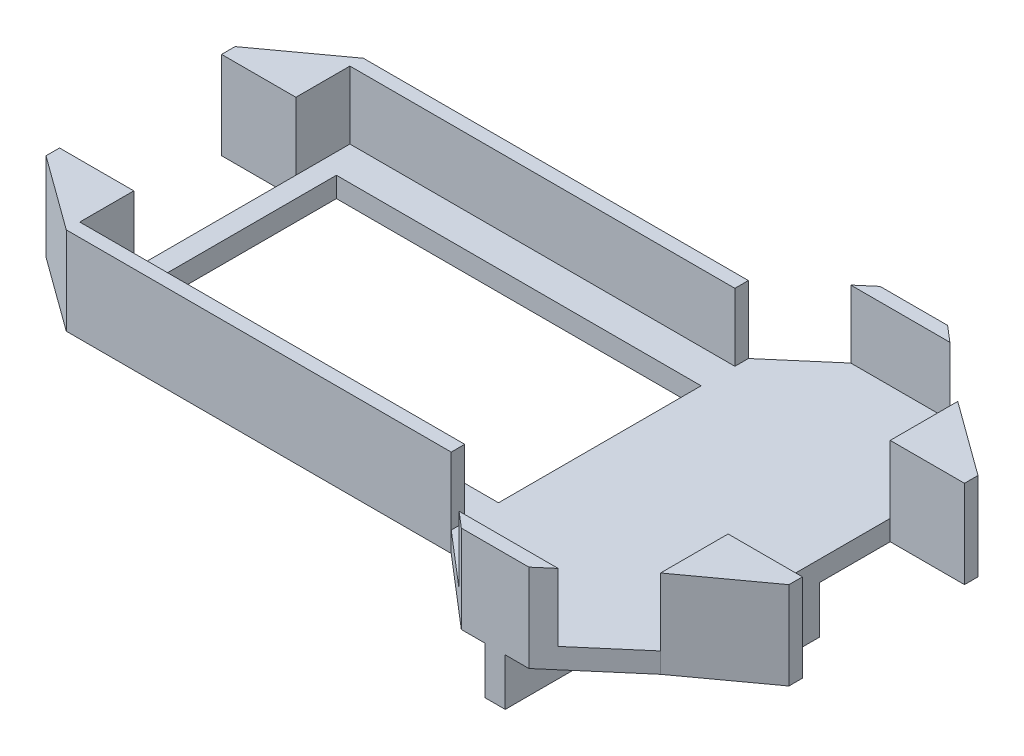
from build123d import *

# Parameters (mm, degrees)
SKETCH2_W           = 54
SKETCH2_H           = 30
BOSS_EXTRUDE1_DEPTH = 3
BOSS_EXTRUDE2_DEPTH = 10
BOSS_EXTRUDE4_DEPTH = 3
BOSS_EXTRUDE5_DEPTH = 10
BOSS_EXTRUDE3_DEPTH = 7


with BuildPart() as part:
    # Sketch2 → Boss-Extrude1 (new body)
    with BuildSketch(Plane(origin=(0, 0, 0), x_dir=(1, 0, 0), z_dir=(0, 1, 0))):
        Polygon((-55, 12), (-44, 12), (-44, -12), (-55, -12), (-55, -14), (-44, -22), (44, -22), (55, -14), (55, -12), (44, -12), (44, 12), (55, 12), (55, 14), (44, 22), (-44, 22), (-55, 14), align=None)
        with Locations((-14, 0)):
            Rectangle(SKETCH2_W, SKETCH2_H, mode=Mode.SUBTRACT)
    extrude(amount=BOSS_EXTRUDE1_DEPTH)

    # Sketch3 → Boss-Extrude2 (add)
    with BuildSketch(Plane(origin=(0, 3, 0), x_dir=(1, 0, 0), z_dir=(0, 1, 0))):
        Polygon((13, 20), (-44, 20), (-44, 12), (-55, 12), (-55, 14), (-44, 22), (13, 22), align=None)
        Polygon((-44, -12), (-44, -20), (13, -20), (13, -22), (-44, -22), (-55, -14), (-55, -12), align=None)
        Polygon((44, 12), (44, 22), (55, 14), (55, 12), align=None)
        Polygon((44, -22), (55, -14), (55, -12), (44, -12), align=None)
    extrude(amount=BOSS_EXTRUDE2_DEPTH)

    # Sketch5 → Boss-Extrude4 (add)
    with BuildSketch(Plane(origin=(0, 3, 0), x_dir=(1, 0, 0), z_dir=(0, 1, 0))):
        Polygon((13, -22), (44, -22), (33.5, -31), (23.5, -31), align=None)
        Polygon((44, 22), (13, 22), (23.5, 31), (33.5, 31), align=None)
    extrude(amount=-BOSS_EXTRUDE4_DEPTH)

    # Sketch6 → Boss-Extrude5 (add)
    with BuildSketch(Plane(origin=(0, 3, 0), x_dir=(1, 0, 0), z_dir=(0, 1, 0))):
        Polygon((21.166666667, -29), (23.5, -31), (33.5, -31), (35.833333333, -29), align=None)
        Polygon((35.833333333, 29), (33.5, 31), (23.5, 31), (21.166666667, 29), align=None)
    extrude(amount=BOSS_EXTRUDE5_DEPTH)

    # Sketch4 → Boss-Extrude3 (add)
    with BuildSketch(Plane.XZ):
        Polygon((13, 1.5), (13, -1.5), (27, -1.5), (27, -31), (30, -31), (30, -1.5), (44, -1.5), (44, 1.5), (30, 1.5), (30, 31), (27, 31), (27, 1.5), align=None)
    extrude(amount=BOSS_EXTRUDE3_DEPTH)


solid = part.part
